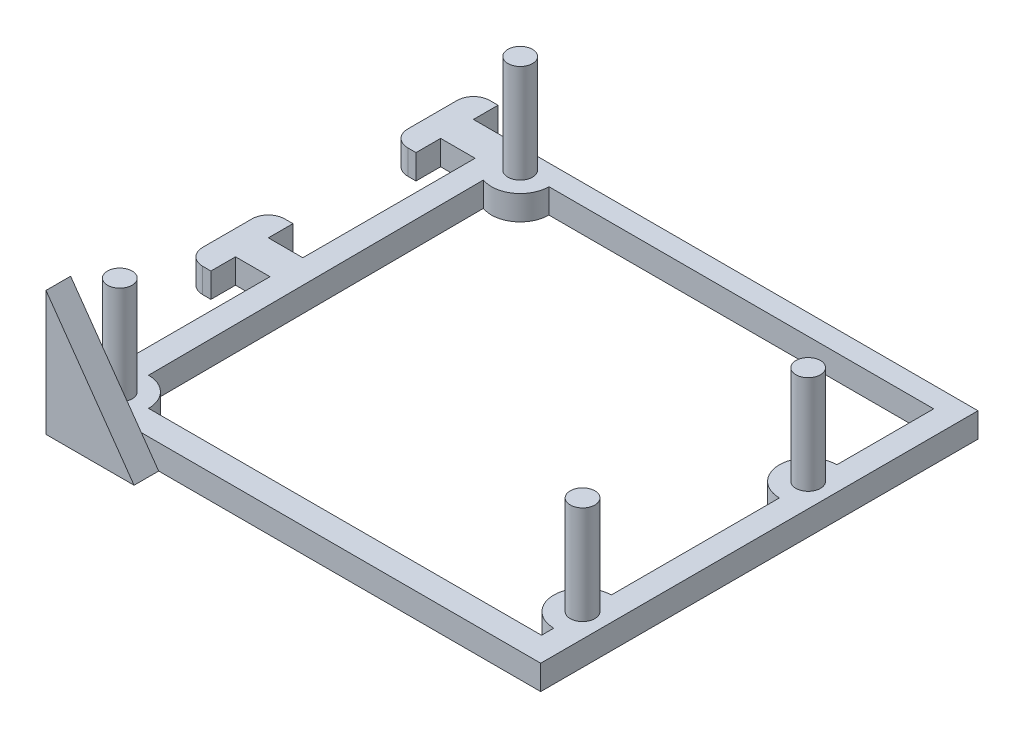
from build123d import *

# Parameters (mm, degrees)
SKETCH1_R           = 1.5
BOSS_EXTRUDE1_DEPTH = 3
BOSS_EXTRUDE2_DEPTH = 3
LPATTERN1_COUNT     = 2
LPATTERN1_PITCH     = 25
BOSS_EXTRUDE3_DEPTH = 3
SKETCH1_4_R         = 1.5
BOSS_EXTRUDE4_DEPTH = 15


with BuildPart() as part:
    # Sketch1 → Boss-Extrude1 (new body)
    with BuildSketch(Plane(origin=(0, 0, 0), x_dir=(1, 0, 0), z_dir=(0, 1, 0))):
        Polygon((0, 49.3), (0, 0), (57.3, 0), (57.3, 53.3), (0, 53.3), (0, 51.3), align=None)
        with Locations((3, 3)):
            Circle(SKETCH1_R, mode=Mode.SUBTRACT)
        with Locations((54.4, 8)):
            Circle(SKETCH1_R, mode=Mode.SUBTRACT)
        with BuildLine():
            ThreePointArc((6.5, 3), (5.474873734, 5.474873734), (3, 6.5))
            Line((3, 6.5), (2.8, 47.512143555))
            ThreePointArc((2.8, 47.512143555), (6.006240265, 47.93207392), (7.5, 50.8))
            Line((7.5, 50.8), (54.4, 50.8))
            Line((54.4, 50.8), (54.4, 39))
            ThreePointArc((54.4, 39), (50.9, 35.5), (54.4, 32))
            Line((54.4, 32), (54.4, 11.5))
            ThreePointArc((54.4, 11.5), (50.9, 8), (54.4, 4.5))
            Line((54.4, 4.5), (54.4, 3))
            Line((54.4, 3), (6.5, 3))
        make_face(mode=Mode.SUBTRACT)
        with Locations((4, 50.8)):
            Circle(SKETCH1_R, mode=Mode.SUBTRACT)
        with Locations((54.4, 35.5)):
            Circle(SKETCH1_R, mode=Mode.SUBTRACT)
    extrude(amount=BOSS_EXTRUDE1_DEPTH)

    # Sketch1<3> → Boss-Extrude2 (add)
    with BuildSketch(Plane(origin=(0, 0, 0), x_dir=(1, 0, 0), z_dir=(0, 1, 0))):
        with BuildLine():
            Line((-4.2, 49.3), (0, 49.3))
            Line((0, 49.3), (0, 51.3))
            Line((0, 51.3), (0, 53.3))
            Line((0, 53.3), (-4.2, 53.3))
            Line((-4.2, 53.3), (-4.2, 56.3))
            Line((-4.2, 56.3), (-5.2, 56.3))
            ThreePointArc((-5.2, 56.3), (-6.614213562, 55.714213562), (-7.2, 54.3))
            Line((-7.2, 54.3), (-7.2, 48.3))
            ThreePointArc((-7.2, 48.3), (-6.614213562, 46.885786438), (-5.2, 46.3))
            Line((-5.2, 46.3), (-4.2, 46.3))
            Line((-4.2, 46.3), (-4.2, 49.3))
        make_face()
    boss_extrude2 = extrude(amount=BOSS_EXTRUDE2_DEPTH)

    # LPattern1: Boss-Extrude2 ×2
    with Locations(*[(0, 0, i * LPATTERN1_PITCH) for i in range(1, LPATTERN1_COUNT)]):
        add(boss_extrude2)

    # Sketch2 → Boss-Extrude3 (add)
    with BuildSketch(Plane.XY):
        Polygon((0, 0), (0, 15.203282646), (10.735764429, 0), align=None)
    extrude(amount=BOSS_EXTRUDE3_DEPTH)

    # Sketch1<4> → Boss-Extrude4 (add)
    with BuildSketch(Plane(origin=(0, 0, 0), x_dir=(1, 0, 0), z_dir=(0, 1, 0))):
        with Locations((4, 50.8)):
            Circle(SKETCH1_4_R)
        with Locations((54.4, 35.5)):
            Circle(SKETCH1_4_R)
        with Locations((54.4, 8)):
            Circle(SKETCH1_4_R)
        with Locations((3, 3)):
            Circle(SKETCH1_4_R)
    extrude(amount=BOSS_EXTRUDE4_DEPTH)


solid = part.part
